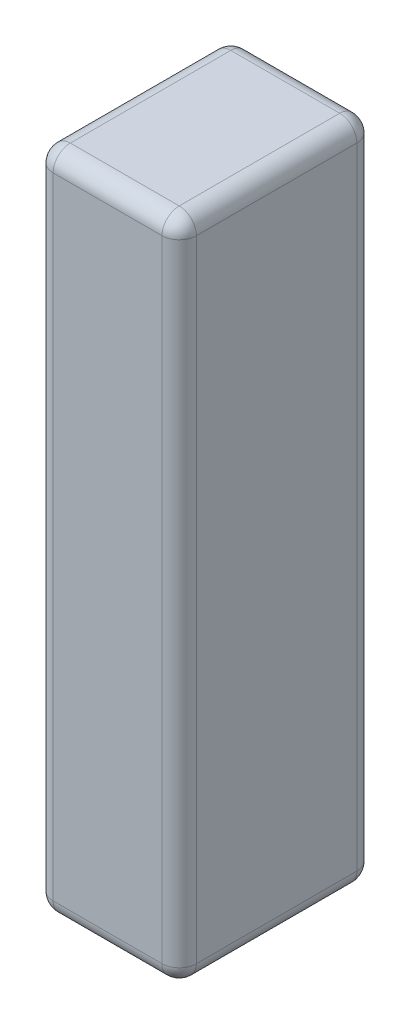
from build123d import *

# Parameters (mm, degrees)
SKETCH1_W           = 25
SKETCH1_H           = 34
BOSS_EXTRUDE1_DEPTH = 116
FILLET1_R           = 3


with BuildPart() as part:
    # Sketch1 → Boss-Extrude1 (new body)
    with BuildSketch(Plane(origin=(0, 0, 0), x_dir=(1, 0, 0), z_dir=(0, 1, 0))):
        Rectangle(SKETCH1_W, SKETCH1_H)
    extrude(amount=BOSS_EXTRUDE1_DEPTH)

    # Fillet1
    fillet1_edges = [part.edges().sort_by_distance(p)[0] for p in [
        (12.5, 116, 0),
        (0, 116, -17),
        (-12.5, 116, 0),
        (0, 0, -17),
        (12.5, 0, 0),
        (0, 0, 17),
        (-12.5, 0, 0),
        (0, 116, 17),
        (-12.5, 58, -17),
        (12.5, 58, -17),
        (12.5, 58, 17),
        (-12.5, 58, 17),
    ]]
    fillet(fillet1_edges, radius=FILLET1_R)


solid = part.part
